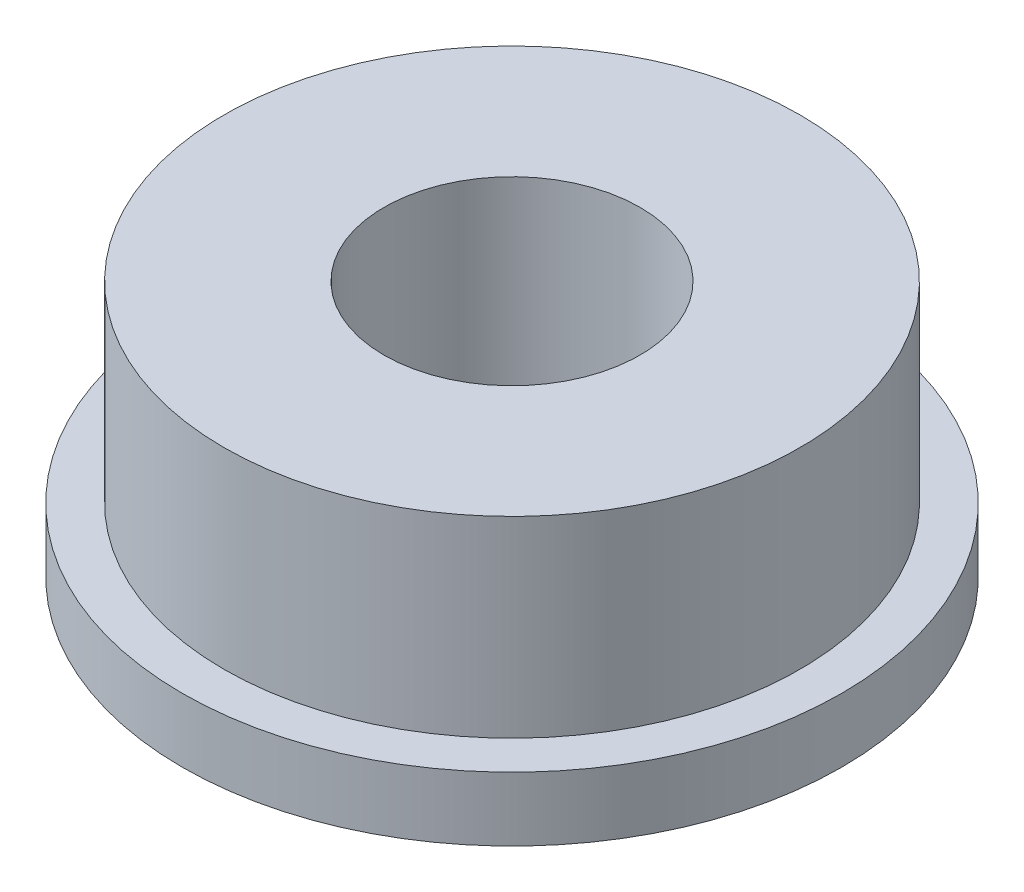
from build123d import *

# Parameters (mm, degrees)
SKETCH_1_R      = 5.15
SKETCH_1_R_2    = 2
EXTRUDE_1_DEPTH = 1
SKETCH_2_R      = 4.5
SKETCH_2_R_2    = 2
EXTRUDE_2_DEPTH = 3


with BuildPart() as part:
    # 草图1 → 凸台-拉伸1 (new body)
    with BuildSketch(Plane(origin=(0, 0, 0), x_dir=(1, 0, 0), z_dir=(0, 1, 0))):
        with Locations(Location((0, 0, 0), (0, 0, 270))):
            Circle(SKETCH_1_R)
        with Locations(Location((0, 0, 0), (0, 0, 270))):
            Circle(SKETCH_1_R_2, mode=Mode.SUBTRACT)
    extrude(amount=EXTRUDE_1_DEPTH)

    # 草图2 → 凸台-拉伸2 (add)
    with BuildSketch(Plane(origin=(0, 1, 0), x_dir=(1, 0, 0), z_dir=(0, 1, 0))):
        with Locations(Location((0, 0, 0), (0, 0, 270))):
            Circle(SKETCH_2_R)
        with Locations(Location((0, 0, 0), (0, 0, 270))):
            Circle(SKETCH_2_R_2, mode=Mode.SUBTRACT)
    extrude(amount=EXTRUDE_2_DEPTH)


solid = part.part
